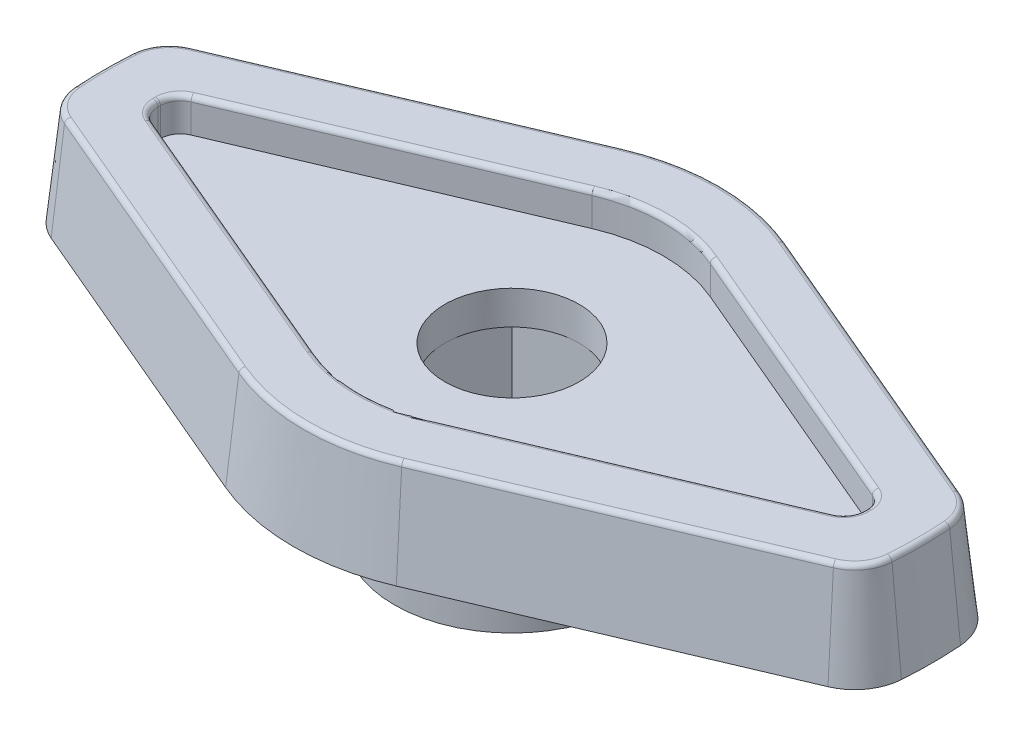
from build123d import *

# Parameters (mm, degrees)
BOSS_EXTRUDE1_DEPTH = 6
BOSS_EXTRUDE1_TAPER = 6
CUT_EXTRUDE1_DEPTH  = 2
FILLET1_R           = 1.2
FILLET2_R           = 0.3
SKETCH3_R           = 7
BOSS_EXTRUDE2_DEPTH = 6
FILLET3_R           = 1
SKETCH4_R           = 4
CUT_EXTRUDE2_DEPTH  = 31.626785825
SKETCH5_W           = 8
SKETCH5_H           = 8
CUT_EXTRUDE3_DEPTH  = 8
SKETCH6_R           = 6
CUT_EXTRUDE4_DEPTH  = 2


with BuildPart() as part:
    # Sketch1 → Boss-Extrude1 (new body)
    with BuildSketch(Plane(origin=(0, 0, 0), x_dir=(1, 0, 0), z_dir=(0, 1, 0))):
        with BuildLine():
            ThreePointArc((5.07950467, 11.966563095), (0, 13), (-5.07950467, 11.966563095))
            Line((-5.07950467, 11.966563095), (-23.117642244, 4.309827964))
            ThreePointArc((-23.117642244, 4.309827964), (-24.387252681, 3.291182903), (-24.938010067, 1.759447049))
            ThreePointArc((-24.938010067, 1.759447049), (-25, 0), (-24.938010067, -1.759447049))
            ThreePointArc((-24.938010067, -1.759447049), (-24.387252681, -3.291182903), (-23.117642244, -4.309827964))
            Line((-23.117642244, -4.309827964), (-5.07950467, -11.966563095))
            ThreePointArc((-5.07950467, -11.966563095), (0, -13), (5.07950467, -11.966563095))
            Line((5.07950467, -11.966563095), (23.117642244, -4.309827964))
            ThreePointArc((23.117642244, -4.309827964), (24.387252681, -3.291182903), (24.938010067, -1.759447049))
            ThreePointArc((24.938010067, -1.759447049), (25, 0), (24.938010067, 1.759447049))
            ThreePointArc((24.938010067, 1.759447049), (24.387252681, 3.291182903), (23.117642244, 4.309827964))
            Line((23.117642244, 4.309827964), (5.07950467, 11.966563095))
        make_face()
    extrude(amount=BOSS_EXTRUDE1_DEPTH, taper=BOSS_EXTRUDE1_TAPER)

    # Sketch2 → Cut-Extrude1 (cut)
    with BuildSketch(Plane(origin=(0, 6, 0), x_dir=(1, 0, 0), z_dir=(0, 1, 0))):
        with BuildLine():
            Line((3.516580156, 8.284543681), (20.981931761, 0.870941769))
            ThreePointArc((20.981931761, 0.870941769), (21, 0), (20.981931761, -0.870941769))
            Line((20.981931761, -0.870941769), (3.516580156, -8.284543681))
            ThreePointArc((3.516580156, -8.284543681), (0, -9), (-3.516580156, -8.284543681))
            Line((-3.516580156, -8.284543681), (-20.981931761, -0.870941769))
            ThreePointArc((-20.981931761, -0.870941769), (-21, 0), (-20.981931761, 0.870941769))
            Line((-20.981931761, 0.870941769), (-3.516580156, 8.284543681))
            ThreePointArc((-3.516580156, 8.284543681), (0, 9), (3.516580156, 8.284543681))
        make_face()
    extrude(amount=-CUT_EXTRUDE1_DEPTH, mode=Mode.SUBTRACT)

    # Fillet1
    fillet1_edges = [part.edges().sort_by_distance(p)[0] for p in [
        (20.981931761, 5, -0.870941769),
        (20.981931761, 5, 0.870941769),
        (-20.981931761, 5, 0.870941769),
        (-20.981931761, 5, -0.870941769),
    ]]
    fillet(fillet1_edges, radius=FILLET1_R)

    # Fillet2
    fillet2_edges = [part.edges().sort_by_distance(p)[0] for p in [
        (23.873964834, 6, -2.924816971),
        (13.852168478, 6, -7.557701777),
        (0, 6, -12.369374588),
        (-13.852168478, 6, -7.557701777),
        (-23.873964834, 6, -2.924816971),
        (-24.369374588, 6, 0),
        (-23.873964834, 6, 2.924816971),
        (-13.852168478, 6, 7.557701777),
        (0, 6, 12.369374588),
        (0, 6, -9),
        (-11.892668536, 6, -4.729105106),
        (0, 6, 9),
        (11.892668536, 6, 4.729105106),
        (13.852168478, 6, 7.557701777),
        (23.873964834, 6, 2.924816971),
        (-21, 6, 0),
        (-11.892668536, 6, 4.729105106),
        (11.892668536, 6, -4.729105106),
        (21, 6, 0),
        (-20.799385958, 6, -0.733129198),
        (-20.799385958, 6, 0.733129198),
        (20.799385958, 6, -0.733129198),
        (20.799385958, 6, 0.733129198),
        (24.369374588, 6, 0),
    ]]
    fillet(fillet2_edges, radius=FILLET2_R)

    # Sketch3 → Boss-Extrude2 (add)
    with BuildSketch(Plane.XZ):
        with Locations(Location((0, 0, 0), (0, 0, 90))):
            Circle(SKETCH3_R)
    extrude(amount=BOSS_EXTRUDE2_DEPTH)

    # Fillet3
    fillet3_edges = [part.edges().sort_by_distance(p)[0] for p in [
        (0, 0, -7),
    ]]
    fillet(fillet3_edges, radius=FILLET3_R)

    # Sketch4 → Cut-Extrude2 (cut, through all)
    with BuildSketch(Plane.XZ.offset(6)):
        with Locations(Location((0, 0, 0), (0, 0, 270))):
            Circle(SKETCH4_R)
    extrude(amount=-CUT_EXTRUDE2_DEPTH, mode=Mode.SUBTRACT)

    # Sketch5 → Cut-Extrude3 (cut)
    with BuildSketch(Plane.XZ.offset(6)):
        Rectangle(SKETCH5_W, SKETCH5_H)
    extrude(amount=-CUT_EXTRUDE3_DEPTH, mode=Mode.SUBTRACT)

    # Sketch6 → Cut-Extrude4 (cut)
    with BuildSketch(Plane.XZ.offset(6)):
        with Locations(Location((0, 0, 0), (0, 0, 270))):
            Circle(SKETCH6_R)
    extrude(amount=-CUT_EXTRUDE4_DEPTH, mode=Mode.SUBTRACT)


solid = part.part
